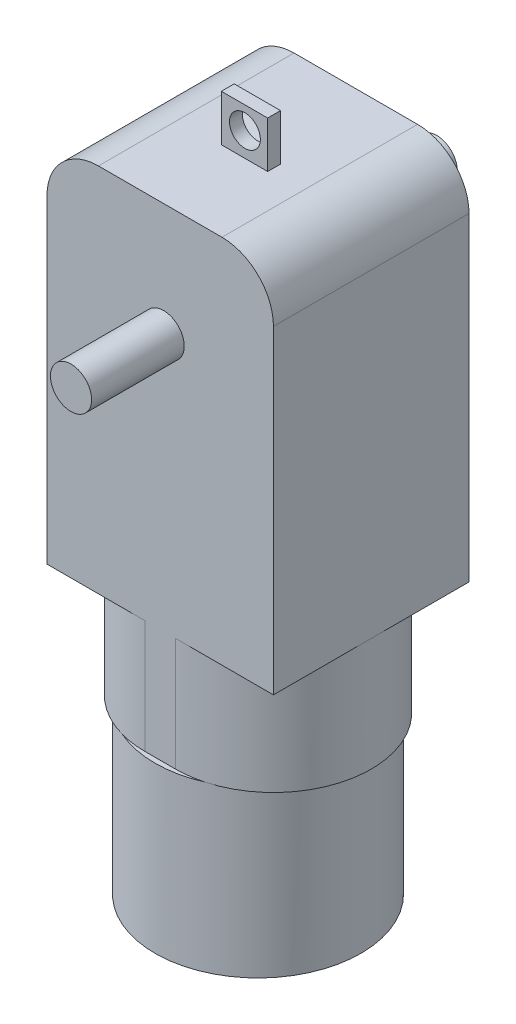
from build123d import *

# Parameters (mm, degrees)
SKETCH_1_W          = 22
SKETCH_1_H          = 36
EXTRUDE_1_DEPTH     = 19
SKETCH_2_W          = 4.5
SKETCH_2_H          = 4.5
EXTRUDE_2_DEPTH     = 1.25
SKETCH_3_R          = 1.5
CUT_EXTRUDE_1_DEPTH = 48.442728631
EXTRUDE_3_DEPTH     = 11
SKETCH_5_R          = 10
EXTRUDE_4_DEPTH     = 16
FILLET_1_R          = 5
SKETCH_6_R          = 2
EXTRUDE_5_DEPTH     = 9
SKETCH_7_R          = 2
EXTRUDE_6_DEPTH     = 9


with BuildPart() as part:
    # ｽｹｯﾁ1 → ﾎﾞｽ - 押し出し1 (new body)
    with BuildSketch(Plane.XY):
        with Locations((11, 18)):
            Rectangle(SKETCH_1_W, SKETCH_1_H)
    extrude(amount=EXTRUDE_1_DEPTH)

    # ｽｹｯﾁ2 → ﾎﾞｽ - 押し出し2 (add)
    with BuildSketch(Plane.XY.offset(10)):
        with Locations((11.44003241, 38.25)):
            Rectangle(SKETCH_2_W, SKETCH_2_H)
    extrude(amount=EXTRUDE_2_DEPTH)

    # ｽｹｯﾁ3 → ｶｯﾄ - 押し出し1 (cut, through all)
    with BuildSketch(Plane.XY.offset(11.25)):
        with Locations((11.478404316, 38.342178873)):
            Circle(SKETCH_3_R)
    extrude(amount=-CUT_EXTRUDE_1_DEPTH, mode=Mode.SUBTRACT)

    # ｽｹｯﾁ4 → ﾎﾞｽ - 押し出し3 (add)
    with BuildSketch(Plane.XZ):
        with BuildLine():
            Line((9.5, 19), (12.5, 19))
            ThreePointArc((12.5, 19), (22, 9.5), (12.5, 0))
            Line((12.5, 0), (9.5, 0))
            ThreePointArc((9.5, 0), (0, 9.5), (9.5, 19))
        make_face()
    extrude(amount=EXTRUDE_3_DEPTH)

    # ｽｹｯﾁ5 → ﾎﾞｽ - 押し出し4 (add)
    with BuildSketch(Plane.XZ.offset(11)):
        with Locations(Location((11, 9.5, 0), (0, 0, 113.578178478))):
            Circle(SKETCH_5_R)
    extrude(amount=EXTRUDE_4_DEPTH)

    # ﾌｨﾚｯﾄ1
    fillet_1_edges = [part.edges().sort_by_distance(p)[0] for p in [
        (0, 36, 9.5),
        (22, 36, 9.5),
    ]]
    fillet(fillet_1_edges, radius=FILLET_1_R)

    # ｽｹｯﾁ6 → ﾎﾞｽ - 押し出し5 (add)
    with BuildSketch(Plane(origin=(0, 0, 0), x_dir=(-1, 0, 0), z_dir=(0, 0, -1))):
        with Locations((-9.86884227, 25)):
            Circle(SKETCH_6_R)
    extrude(amount=EXTRUDE_5_DEPTH)

    # ｽｹｯﾁ7 → ﾎﾞｽ - 押し出し6 (add)
    with BuildSketch(Plane.XY.offset(19)):
        with Locations(Location((11.335077521, 25, 0), (0, 0, 180))):
            Circle(SKETCH_7_R)
    extrude(amount=EXTRUDE_6_DEPTH)


solid = part.part
